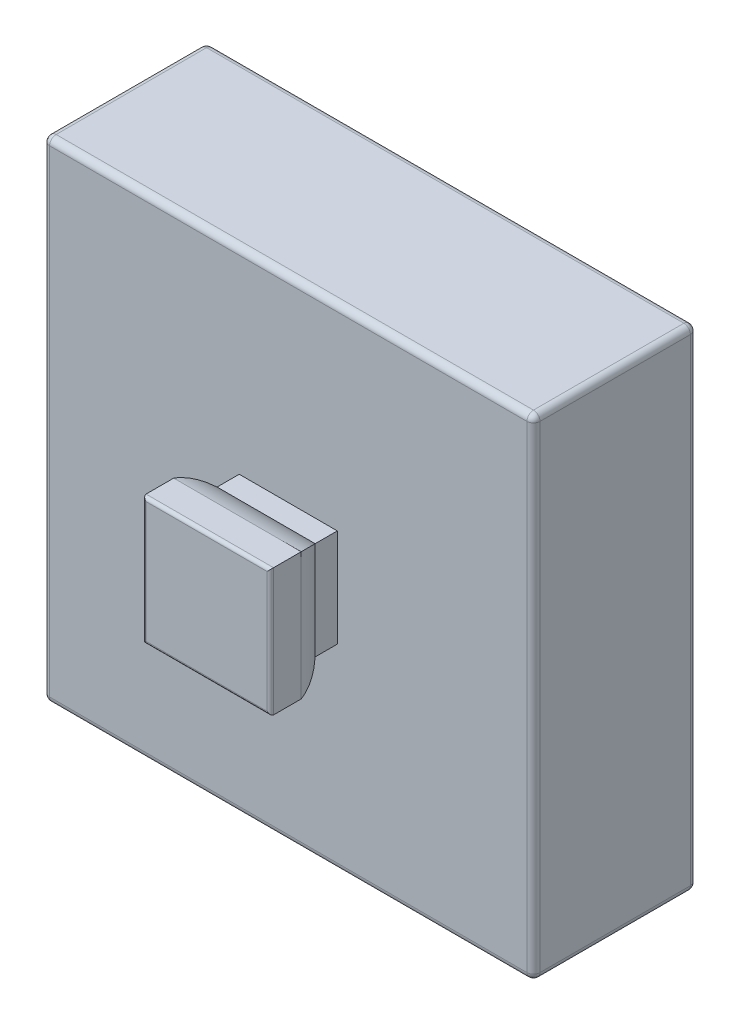
from build123d import *

# Parameters (mm, degrees)
SKETCH_1_W                      = 15
SKETCH_1_H                      = 15
EXTRUDE_1_DEPTH                 = 5
SKETCH_2_W                      = 3
SKETCH_2_H                      = 3
EXTRUDE_2_DEPTH                 = 1
EXTRUDE_3_DEPTH                 = 2
CUT_EXTRUDE_1_REACH             = 13.726
CUT_EXTRUDE_1_DIRECTION_2_REACH = 13.726
FILLET_1_R                      = 0.1
FILLET_1_OF_MIRROR_1_R          = 0.1
FILLET_2_R                      = 0.2


with BuildPart() as part:
    # 草图1 → 凸台-拉伸1 (new body)
    with BuildSketch(Plane.XY):
        Rectangle(SKETCH_1_W, SKETCH_1_H)
    extrude(amount=-EXTRUDE_1_DEPTH)

    # 草图2 → 凸台-拉伸2 (add)
    with BuildSketch(Plane.XY):
        Rectangle(SKETCH_2_W, SKETCH_2_H)
    extrude_2 = extrude(amount=EXTRUDE_2_DEPTH)

    # 草图3 → 凸台-拉伸3 (add, symmetric)
    with BuildSketch(Plane(origin=(0, 0, 0), x_dir=(1, 0, 0), z_dir=(0, 1, 0))):
        with BuildLine():
            Line((-1.95, -2.5), (1.95, -2.5))
            Line((1.95, -2.5), (1.95, -1.555590279))
            ThreePointArc((1.95, -1.555590279), (1.780042303, -1.088161527), (1.5, -0.677124344))
            Line((1.5, -0.677124344), (-1.5, -0.677124344))
            ThreePointArc((-1.5, -0.677124344), (-1.780042303, -1.088161527), (-1.95, -1.555590279))
            Line((-1.95, -1.555590279), (-1.95, -2.5))
        make_face()
    extrude_3 = extrude(amount=EXTRUDE_3_DEPTH, both=True)

    # 草图4 → 切除-拉伸1 (cut, up to next)
    with BuildSketch(Plane(origin=(0, 0, 0), x_dir=(0, 0, -1), z_dir=(1, 0, 0)), mode=Mode.PRIVATE) as cut_extrude_1_sk1:
        with BuildLine():
            Line((-2.5, 1.95), (-1.555590279, 1.95))
            ThreePointArc((-1.555590279, 1.95), (-1.088161527, 1.780042303), (-0.677124344, 1.5))
            Line((-0.677124344, 1.5), (-0.677124344, 2))
            Line((-0.677124344, 2), (-2.5, 2))
            Line((-2.5, 2), (-2.5, 1.95))
        make_face()
    cut_extrude_1_tool1 = extrude(cut_extrude_1_sk1.sketch, amount=-CUT_EXTRUDE_1_REACH, mode=Mode.PRIVATE) & part.part
    # 草图4 → 切除-拉伸1 (cut, up to next)
    with BuildSketch(Plane(origin=(0, 0, 0), x_dir=(0, 0, -1), z_dir=(1, 0, 0)), mode=Mode.PRIVATE) as cut_extrude_1_sk2:
        with BuildLine():
            Line((-2.5, -2), (-0.677124344, -2))
            Line((-0.677124344, -2), (-0.677124344, -1.5))
            ThreePointArc((-0.677124344, -1.5), (-1.088161527, -1.780042303), (-1.555590279, -1.95))
            Line((-1.555590279, -1.95), (-2.5, -1.95))
            Line((-2.5, -1.95), (-2.5, -2))
        make_face()
    cut_extrude_1_tool2 = extrude(cut_extrude_1_sk2.sketch, amount=-CUT_EXTRUDE_1_REACH, mode=Mode.PRIVATE) & part.part
    cut_extrude_1_1 = cut_extrude_1_tool1.solids().sort_by_distance((0, 1.873038, 1.175075))[0]
    add(cut_extrude_1_1, mode=Mode.SUBTRACT)
    cut_extrude_1_2 = cut_extrude_1_tool2.solids().sort_by_distance((0, -1.873038, 1.175075))[0]
    add(cut_extrude_1_2, mode=Mode.SUBTRACT)
    cut_extrude_1 = cut_extrude_1_1 + cut_extrude_1_2  # 切除-拉伸1 as one shape, for the pattern or mirror that repeats it

    # 草图4 → 切除-拉伸1 direction 2 (cut, up to next)
    with BuildSketch(Plane(origin=(0, 0, 0), x_dir=(0, 0, -1), z_dir=(1, 0, 0)), mode=Mode.PRIVATE) as cut_extrude_1_direction_2_sk1:
        with BuildLine():
            Line((-2.5, 1.95), (-1.555590279, 1.95))
            ThreePointArc((-1.555590279, 1.95), (-1.088161527, 1.780042303), (-0.677124344, 1.5))
            Line((-0.677124344, 1.5), (-0.677124344, 2))
            Line((-0.677124344, 2), (-2.5, 2))
            Line((-2.5, 2), (-2.5, 1.95))
        make_face()
    cut_extrude_1_direction_2_tool1 = extrude(cut_extrude_1_direction_2_sk1.sketch, amount=CUT_EXTRUDE_1_DIRECTION_2_REACH, mode=Mode.PRIVATE) & part.part
    # 草图4 → 切除-拉伸1 direction 2 (cut, up to next)
    with BuildSketch(Plane(origin=(0, 0, 0), x_dir=(0, 0, -1), z_dir=(1, 0, 0)), mode=Mode.PRIVATE) as cut_extrude_1_direction_2_sk2:
        with BuildLine():
            Line((-2.5, -2), (-0.677124344, -2))
            Line((-0.677124344, -2), (-0.677124344, -1.5))
            ThreePointArc((-0.677124344, -1.5), (-1.088161527, -1.780042303), (-1.555590279, -1.95))
            Line((-1.555590279, -1.95), (-2.5, -1.95))
            Line((-2.5, -1.95), (-2.5, -2))
        make_face()
    cut_extrude_1_direction_2_tool2 = extrude(cut_extrude_1_direction_2_sk2.sketch, amount=CUT_EXTRUDE_1_DIRECTION_2_REACH, mode=Mode.PRIVATE) & part.part
    cut_extrude_1_direction_2_1 = cut_extrude_1_direction_2_tool1.solids().sort_by_distance((0, 1.873038, 1.175075))[0]
    add(cut_extrude_1_direction_2_1, mode=Mode.SUBTRACT)
    cut_extrude_1_direction_2_2 = cut_extrude_1_direction_2_tool2.solids().sort_by_distance((0, -1.873038, 1.175075))[0]
    add(cut_extrude_1_direction_2_2, mode=Mode.SUBTRACT)
    cut_extrude_1_direction_2 = cut_extrude_1_direction_2_1 + cut_extrude_1_direction_2_2  # 切除-拉伸1 direction 2 as one shape, for the pattern or mirror that repeats it

    # 圆角1
    fillet_1_edges = [part.edges().sort_by_distance(p)[0] for p in [
        (-1.95, 0, 2.5),
        (1.95, 0, 2.5),
        (0, -1.95, 2.5),
        (0, 1.95, 2.5),
    ]]
    fillet(fillet_1_edges, radius=FILLET_1_R)

    # 镜向1: 凸台-拉伸2, 凸台-拉伸3, 切除-拉伸1, 切除-拉伸1 direction 2 across plane
    add(extrude_2.mirror(Plane.XY.offset(-2.5)))
    add(extrude_3.mirror(Plane.XY.offset(-2.5)))
    add(cut_extrude_1.mirror(Plane.XY.offset(-2.5)), mode=Mode.SUBTRACT)
    add(cut_extrude_1_direction_2.mirror(Plane.XY.offset(-2.5)), mode=Mode.SUBTRACT)

    # 圆角1 of 镜向1
    fillet_1_of_mirror_1_edges = [part.edges().sort_by_distance(p)[0] for p in [
        (-1.95, 0, -7.5),
        (1.95, 0, -7.5),
        (0, -1.95, -7.5),
        (0, 1.95, -7.5),
    ]]
    fillet(fillet_1_of_mirror_1_edges, radius=FILLET_1_OF_MIRROR_1_R)

    # 圆角2
    fillet_2_edges = [part.edges().sort_by_distance(p)[0] for p in [
        (7.5, 0, -5),
        (0, 7.5, -5),
        (-7.5, 0, -5),
        (0, 7.5, 0),
        (7.5, 0, 0),
        (0, -7.5, 0),
        (-7.5, 0, 0),
        (0, -7.5, -5),
        (-7.5, 7.5, -2.5),
        (7.5, 7.5, -2.5),
        (7.5, -7.5, -2.5),
        (-7.5, -7.5, -2.5),
    ]]
    fillet(fillet_2_edges, radius=FILLET_2_R)


solid = part.part
